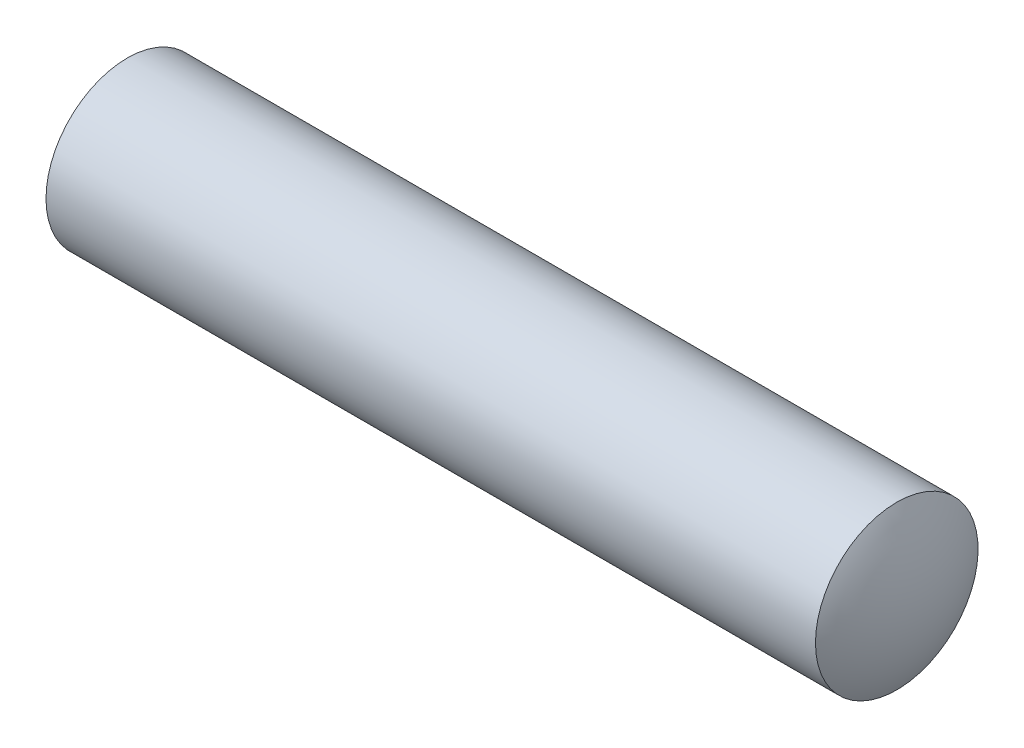
from build123d import *


with BuildPart() as part:
    # Esquisse1 → Base-Révolution (revolve)
    with BuildSketch(Plane.XY):
        with BuildLine():
            Line((0.401923789, 13), (14.598076211, 13))
            ThreePointArc((14.598076211, 13), (14.897777479, 12.276457135), (15, 11.5))
            Line((15, 11.5), (0, 11.5))
            ThreePointArc((0, 11.5), (0.102222521, 12.276457135), (0.401923789, 13))
        make_face()
    revolve(axis=Axis((-30, 11.5, 0), (1, 0, 0)))


solid = part.part
